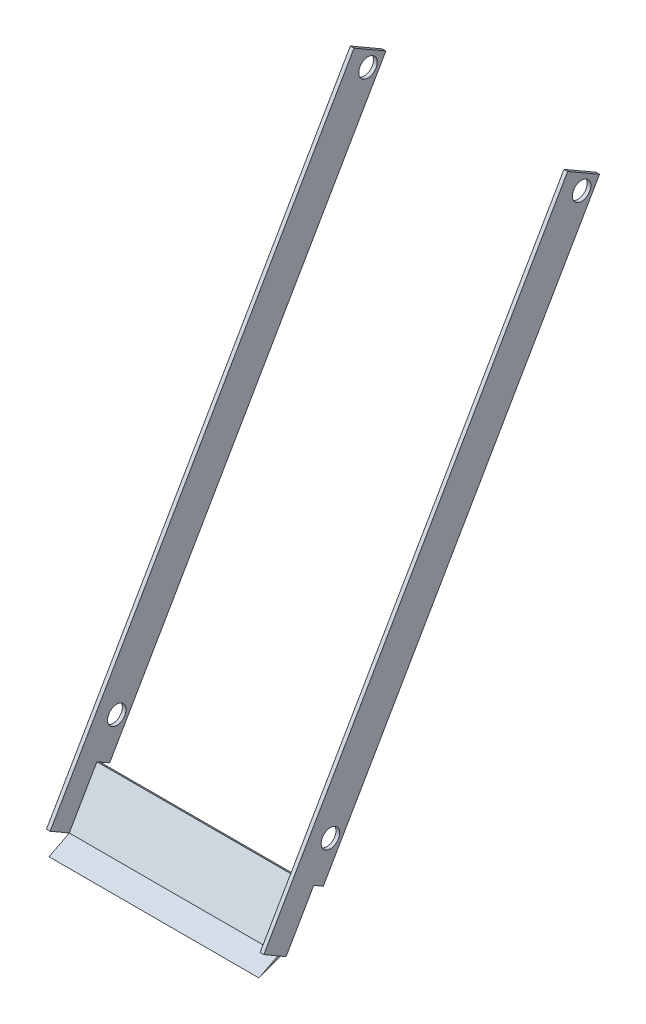
from build123d import *

# Parameters (mm, degrees)
BOSS_EXTRUDE1_DEPTH = 1140
BOSS_EXTRUDE2_DEPTH = 20
BOSS_EXTRUDE3_DEPTH = 20
SKETCH4_W           = 20
SKETCH4_H           = 140
BOSS_EXTRUDE4_DEPTH = 2999.8
SKETCH5_W           = 20
SKETCH5_H           = 140
BOSS_EXTRUDE5_DEPTH = 2999.8
SKETCH7_W           = 20
SKETCH7_H           = 2999.8
BOSS_EXTRUDE6_DEPTH = 60
SKETCH8_W           = 20
SKETCH8_H           = 2999.8
BOSS_EXTRUDE7_DEPTH = 60
CUT_EXTRUDE3_DEPTH  = 3587.157019078


with BuildPart() as part:
    # Sketch1 → Boss-Extrude1 (new body)
    with BuildSketch(Plane(origin=(0, 0, 0), x_dir=(0, 0, -1), z_dir=(1, 0, 0))):
        Polygon((158.660254038, 254.807621135), (141.339745962, 264.807621135), (-8.683943562, 4.958968541), (-118.640466011, -51.98357266), (8.636564514, -5.041031459), align=None)
    extrude(amount=BOSS_EXTRUDE1_DEPTH)

    # Sketch2 → Boss-Extrude2 (add)
    with BuildSketch(Plane(origin=(1140, 0, 0), x_dir=(0, 0, -1), z_dir=(1, 0, 0))):
        Polygon((8.636564514, -5.041031459), (158.660254038, 254.807621135), (37.416697508, 324.807621135), (-112.606992016, 64.958968541), align=None)
    extrude(amount=BOSS_EXTRUDE2_DEPTH)

    # Sketch3 → Boss-Extrude3 (add)
    with BuildSketch(Plane.ZY):
        Polygon((-158.660254038, 254.807621135), (-37.416697508, 324.807621135), (112.606992016, 64.958968541), (-8.636564514, -5.041031459), align=None)
    extrude(amount=BOSS_EXTRUDE3_DEPTH)

    # Sketch4 → Boss-Extrude4 (add)
    with BuildSketch(Plane(origin=(0, 259.807621135, -150), x_dir=(1, 0, 0), z_dir=(0, 0.8660254037844397, -0.4999999999999983))):
        with Locations((1150, -60)):
            Rectangle(SKETCH4_W, SKETCH4_H)
    extrude(amount=BOSS_EXTRUDE4_DEPTH)

    # Sketch5 → Boss-Extrude5 (add)
    with BuildSketch(Plane(origin=(0, 259.807621135, -150), x_dir=(1, 0, 0), z_dir=(0, 0.8660254037844396, -0.4999999999999982))):
        with Locations((-10, -60)):
            Rectangle(SKETCH5_W, SKETCH5_H)
    extrude(amount=BOSS_EXTRUDE5_DEPTH)

    # Sketch7 → Boss-Extrude6 (add)
    with BuildSketch(Plane(origin=(0, -5, -8.660254038), x_dir=(-1, 0, 0), z_dir=(0, -0.49999999999999756, -0.86602540378444))):
        with Locations((-1150, 1799.9)):
            Rectangle(SKETCH7_W, SKETCH7_H)
    extrude(amount=BOSS_EXTRUDE6_DEPTH)

    # Sketch8 → Boss-Extrude7 (add)
    with BuildSketch(Plane(origin=(0, -5, -8.660254038), x_dir=(-1, 0, 0), z_dir=(0, -0.49999999999999756, -0.86602540378444))):
        with Locations((10, 1799.9)):
            Rectangle(SKETCH8_W, SKETCH8_H)
    extrude(amount=BOSS_EXTRUDE7_DEPTH)

    # Sketch10 → Cut-Extrude3 (cut, through all)
    with BuildSketch(Plane(origin=(1160, 0, 0), x_dir=(0, 0, -1), z_dir=(1, 0, 0))):
        with BuildLine():
            ThreePointArc((274.2, 474.928331435), (205.898729811, 456.627061246), (224.2, 388.325791057))
            Line((224.2, 388.325791057), (274.2, 474.928331435))
        make_face()
        with BuildLine():
            Line((274.2, 474.928331435), (224.2, 388.325791057))
            ThreePointArc((224.2, 388.325791057), (274.2, 388.325791057), (299.2, 431.627061246))
            ThreePointArc((299.2, 431.627061246), (292.501270189, 456.627061246), (274.2, 474.928331435))
        make_face()
        with BuildLine():
            ThreePointArc((1638.2, 2837.445632959), (1569.898729811, 2819.14436277), (1588.2, 2750.843092581))
            Line((1588.2, 2750.843092581), (1638.2, 2837.445632959))
        make_face()
        with BuildLine():
            Line((1638.2, 2837.445632959), (1588.2, 2750.843092581))
            ThreePointArc((1588.2, 2750.843092581), (1638.2, 2750.843092581), (1663.2, 2794.14436277))
            ThreePointArc((1663.2, 2794.14436277), (1656.501270189, 2819.14436277), (1638.2, 2837.445632959))
        make_face()
    extrude(amount=-CUT_EXTRUDE3_DEPTH, mode=Mode.SUBTRACT)


solid = part.part
